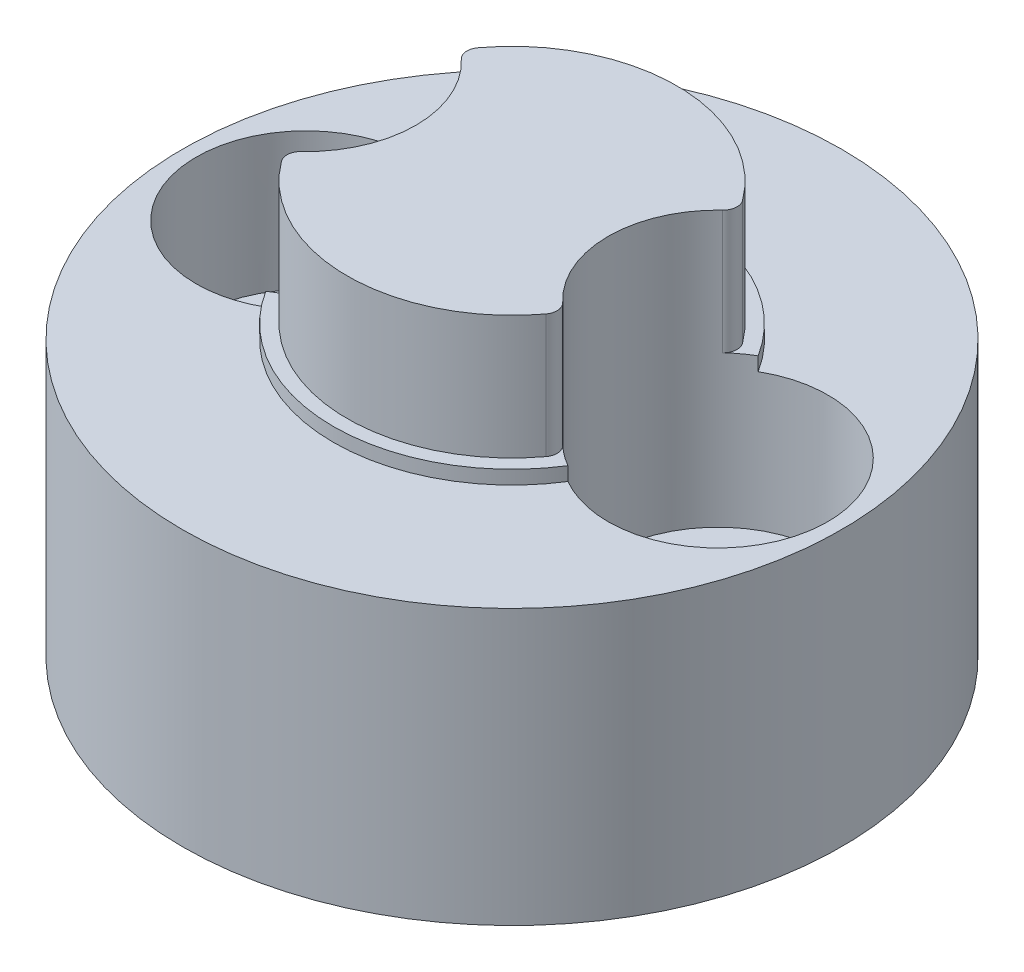
from build123d import *
from build123d.topology import SkipClean

# Parameters (mm, degrees)
SKETCH_1_R          = 12
SKETCH_1_R_2        = 2.15
EXTRUDE_1_DEPTH     = 15
CUT_EXTRUDE_START   = -5
SKETCH_2_R          = 12
CUT_EXTRUDE_1_DEPTH = 5
EXTRUDE_2_DEPTH     = 0.5
SKETCH_4_R          = 4
CUT_EXTRUDE_2_DEPTH = 10
FILLET_1_R          = 0.5


with BuildPart() as part:
    # ｽｹｯﾁ1 → ﾎﾞｽ - 押し出し1 (new body)
    with BuildSketch(Plane(origin=(0, 0, 0), x_dir=(1, 0, 0), z_dir=(0, 1, 0))):
        with Locations(Location((0, 0, 0), (0, 0, 270))):
            Circle(SKETCH_1_R)
        with Locations(Location((-7.5, 0, 0), (0, 0, 270))):
            Circle(SKETCH_1_R_2, mode=Mode.SUBTRACT)
        with Locations(Location((7.5, 0, 0), (0, 0, 90))):
            Circle(SKETCH_1_R_2, mode=Mode.SUBTRACT)
    extrude(amount=EXTRUDE_1_DEPTH)

    # ｽｹｯﾁ2 → ｶｯﾄ - 押し出し1 (cut)
    with BuildSketch(Plane(origin=(0, 15, 0), x_dir=(1, 0, 0), z_dir=(0, 1, 0)).offset(CUT_EXTRUDE_START)):
        with Locations(Location((0, 0, 0), (0, 0, 270))):
            Circle(SKETCH_2_R)
        with BuildLine():
            ThreePointArc((5.841833333, 1.368569803), (0, 6), (-5.841833333, 1.368569803))
            ThreePointArc((-5.841833333, 1.368569803), (-5.35, 0), (-5.841833333, -1.368569803))
            ThreePointArc((-5.841833333, -1.368569803), (0, -6), (5.841833333, -1.368569803))
            ThreePointArc((5.841833333, -1.368569803), (5.35, 0), (5.841833333, 1.368569803))
        make_face(mode=Mode.SUBTRACT)
    extrude(amount=CUT_EXTRUDE_1_DEPTH, mode=Mode.SUBTRACT)

    # ｽｹｯﾁ3 → ﾎﾞｽ - 押し出し2 (add)
    with SkipClean():  # the faces are left unmerged after this step: merging them gives an invalid solid
        with BuildSketch(Plane(origin=(0, 10, 0), x_dir=(1, 0, 0), z_dir=(0, 1, 0))):
            with BuildLine():
                ThreePointArc((-6.2585, -1.755328388), (0, -6.5), (6.2585, -1.755328388))
                ThreePointArc((6.2585, -1.755328388), (6.03732702, -1.575781633), (5.841833333, -1.368569803))
                ThreePointArc((5.841833333, -1.368569803), (5.35, 0), (5.841833333, 1.368569803))
                ThreePointArc((5.841833333, 1.368569803), (6.03732702, 1.575781633), (6.2585, 1.755328388))
                ThreePointArc((6.2585, 1.755328388), (0, 6.5), (-6.2585, 1.755328388))
                ThreePointArc((-6.2585, 1.755328388), (-6.03732702, 1.575781633), (-5.841833333, 1.368569803))
                ThreePointArc((-5.841833333, 1.368569803), (-5.35, 0), (-5.841833333, -1.368569803))
                ThreePointArc((-5.841833333, -1.368569803), (-6.03732702, -1.575781633), (-6.2585, -1.755328388))
            make_face()
        extrude(amount=EXTRUDE_2_DEPTH)

    # ｽｹｯﾁ4 → ｶｯﾄ - 押し出し2 (cut)
    with BuildSketch(Plane(origin=(0, 15, 0), x_dir=(1, 0, 0), z_dir=(0, 1, 0))):
        with Locations(Location((-7.5, 0, 0), (0, 0, 270))):
            Circle(SKETCH_4_R)
        with Locations(Location((7.5, 0, 0), (0, 0, 270))):
            Circle(SKETCH_4_R)
    extrude(amount=-CUT_EXTRUDE_2_DEPTH, mode=Mode.SUBTRACT)

    # ﾌｨﾚｯﾄ1
    fillet_1_edges = [part.edges().sort_by_distance(p)[0] for p in [
        (-5.083333333, 12.75, 3.187431916),
        (-5.083333333, 12.75, -3.187431916),
        (5.083333333, 12.75, 3.187431916),
        (5.083333333, 12.75, -3.187431916),
    ]]
    fillet(fillet_1_edges, radius=FILLET_1_R)


solid = part.part
